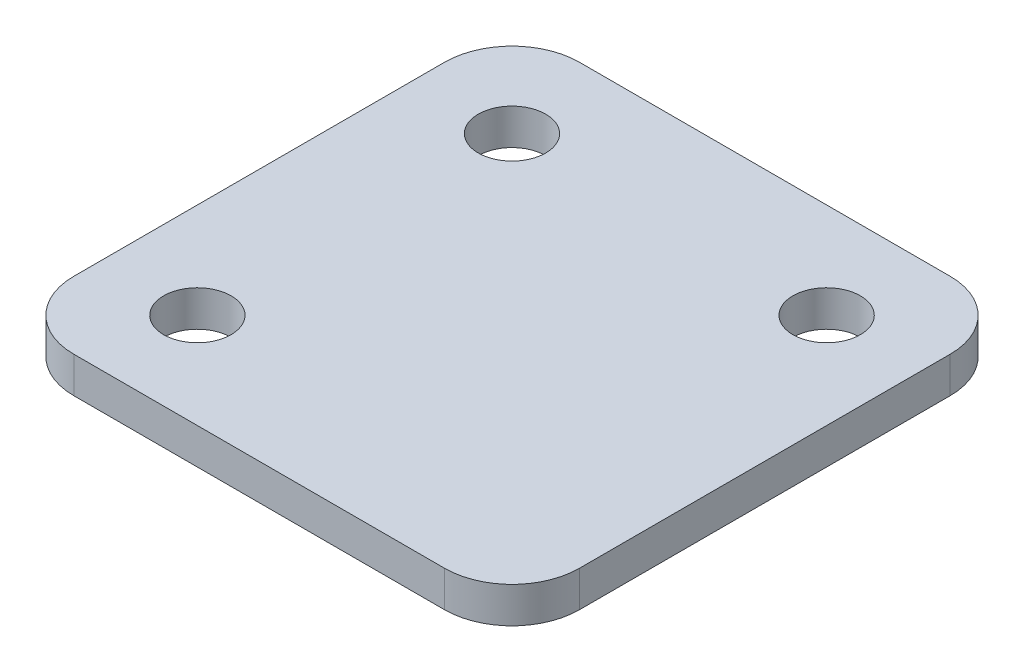
from build123d import *

# Parameters (mm, degrees)
SKETCH1_R           = 1.5
BOSS_EXTRUDE1_DEPTH = 1.6
SKETCH2_W           = 4.3
SKETCH2_H           = 5.2
BOSS_EXTRUDE2_DEPTH = 1


with BuildPart() as part:
    # Sketch1 → Boss-Extrude1 (new body)
    with BuildSketch(Plane(origin=(0, 0, 0), x_dir=(1, 0, 0), z_dir=(0, 1, 0))):
        with BuildLine():
            Line((8.25, 11.25), (-8.25, 11.25))
            ThreePointArc((-8.25, 11.25), (-10.371320344, 10.371320344), (-11.25, 8.25))
            Line((-11.25, 8.25), (-11.25, -8.25))
            ThreePointArc((-11.25, -8.25), (-10.371320344, -10.371320344), (-8.25, -11.25))
            Line((-8.25, -11.25), (8.25, -11.25))
            ThreePointArc((8.25, -11.25), (10.371320344, -10.371320344), (11.25, -8.25))
            Line((11.25, -8.25), (11.25, 8.25))
            ThreePointArc((11.25, 8.25), (10.371320344, 10.371320344), (8.25, 11.25))
        make_face()
        with Locations(Location((7, 7, 0), (0, 0, 270))):
            Circle(SKETCH1_R, mode=Mode.SUBTRACT)
        with Locations(Location((-7, 7, 0), (0, 0, 90))):
            Circle(SKETCH1_R, mode=Mode.SUBTRACT)
        with Locations(Location((-7, -7, 0), (0, 0, 270))):
            Circle(SKETCH1_R, mode=Mode.SUBTRACT)
    extrude(amount=BOSS_EXTRUDE1_DEPTH)

    # Sketch2 → Boss-Extrude2 (add)
    with BuildSketch(Plane.XZ):
        Rectangle(SKETCH2_W, SKETCH2_H)
    extrude(amount=BOSS_EXTRUDE2_DEPTH)


solid = part.part
